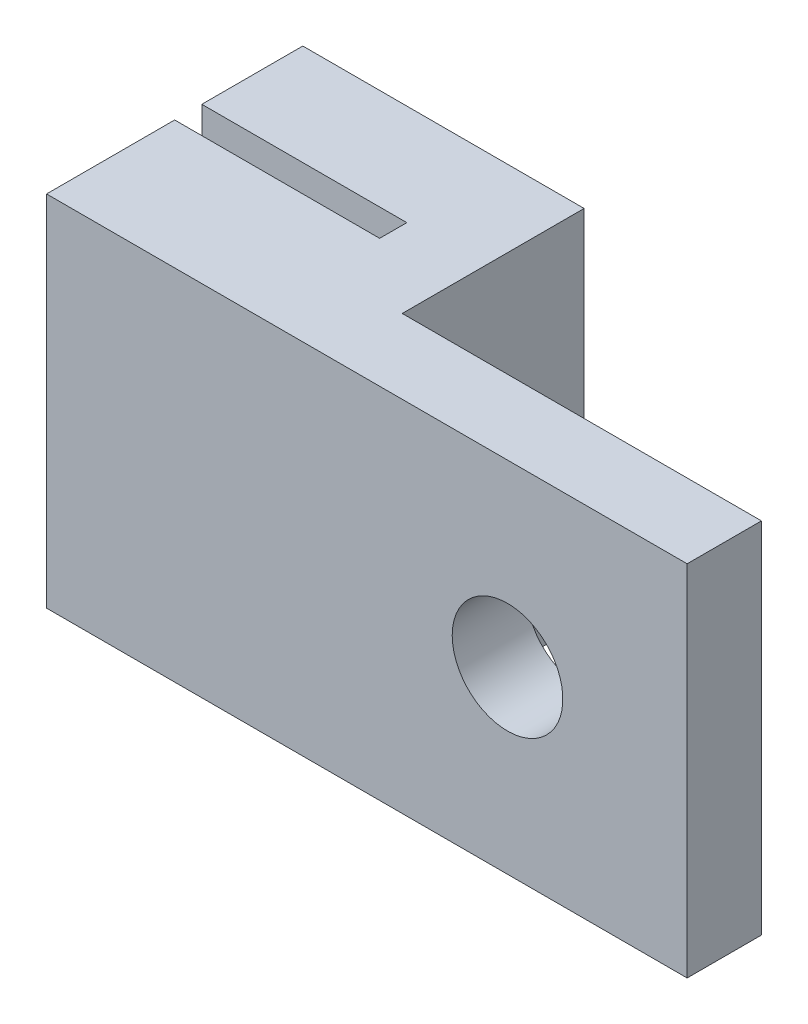
from build123d import *

# Parameters (mm, degrees)
BOSS_EXTRUDE1_DEPTH = 14
SKETCH2_W           = 14.019698715
SKETCH2_H           = 7.099583751
CUT_EXTRUDE1_DEPTH  = 1301.121764584
SKETCH4_R           = 2.159
CUT_EXTRUDE2_DEPTH  = 1238.809657762


with BuildPart() as part:
    # Sketch1 → Boss-Extrude1 (new body)
    with BuildSketch(Plane(origin=(0, 0, 0), x_dir=(1, 0, 0), z_dir=(0, 1, 0))):
        Polygon((-1237.710121457, -392.736417727), (-1237.710121457, -397.736417727), (-1212.710121457, -397.736417727), (-1212.710121457, -387.736417727), (-1237.710121457, -387.736417727), (-1237.710121457, -391.676417727), (-1229.710121457, -391.676417727), (-1229.710121457, -392.736417727), align=None)
    extrude(amount=-BOSS_EXTRUDE1_DEPTH)

    # Sketch2 → Cut-Extrude1 (cut, through all)
    with BuildSketch(Plane(origin=(0, 0, 0), x_dir=(1, 0, 0), z_dir=(0, 1, 0))):
        with Locations((-1219.719970814, -391.286209602)):
            Rectangle(SKETCH2_W, SKETCH2_H)
    extrude(amount=-CUT_EXTRUDE1_DEPTH, mode=Mode.SUBTRACT)

    # Sketch4 → Cut-Extrude2 (cut, through all)
    with BuildSketch(Plane(origin=(0, 0, 394.836001478), x_dir=(-1, 0, 0), z_dir=(0, 0, -1))):
        with Locations((1219.719970815, -7)):
            Circle(SKETCH4_R)
    extrude(amount=-CUT_EXTRUDE2_DEPTH, mode=Mode.SUBTRACT)


solid = part.part
